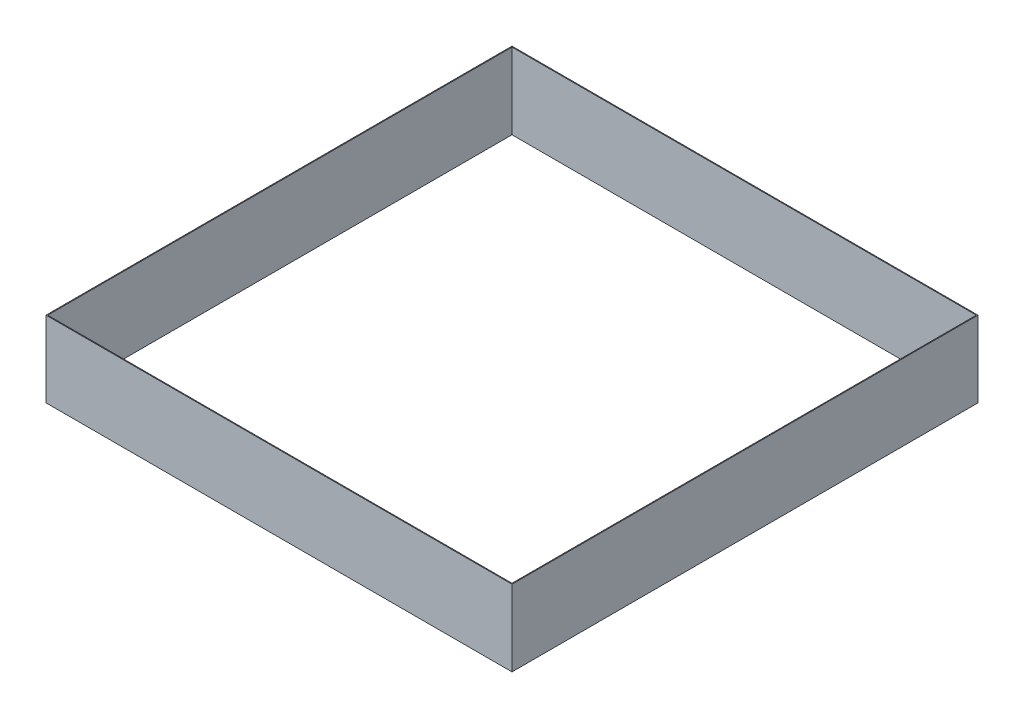
from build123d import *

# Parameters (mm, degrees)
SKETCH_1_W      = 331.2
SKETCH_1_H      = 331.2
SKETCH_1_W_2    = 330
SKETCH_1_H_2    = 330
EXTRUDE_1_DEPTH = 54


with BuildPart() as part:
    # 草图1 → 凸台-拉伸1 (new body)
    with BuildSketch(Plane(origin=(0, 0, 0), x_dir=(1, 0, 0), z_dir=(0, 1, 0))):
        with Locations((165.6, -165.6)):
            Rectangle(SKETCH_1_W, SKETCH_1_H)
        with Locations((165.6, -165.6)):
            Rectangle(SKETCH_1_W_2, SKETCH_1_H_2, mode=Mode.SUBTRACT)
    extrude(amount=EXTRUDE_1_DEPTH)


solid = part.part
